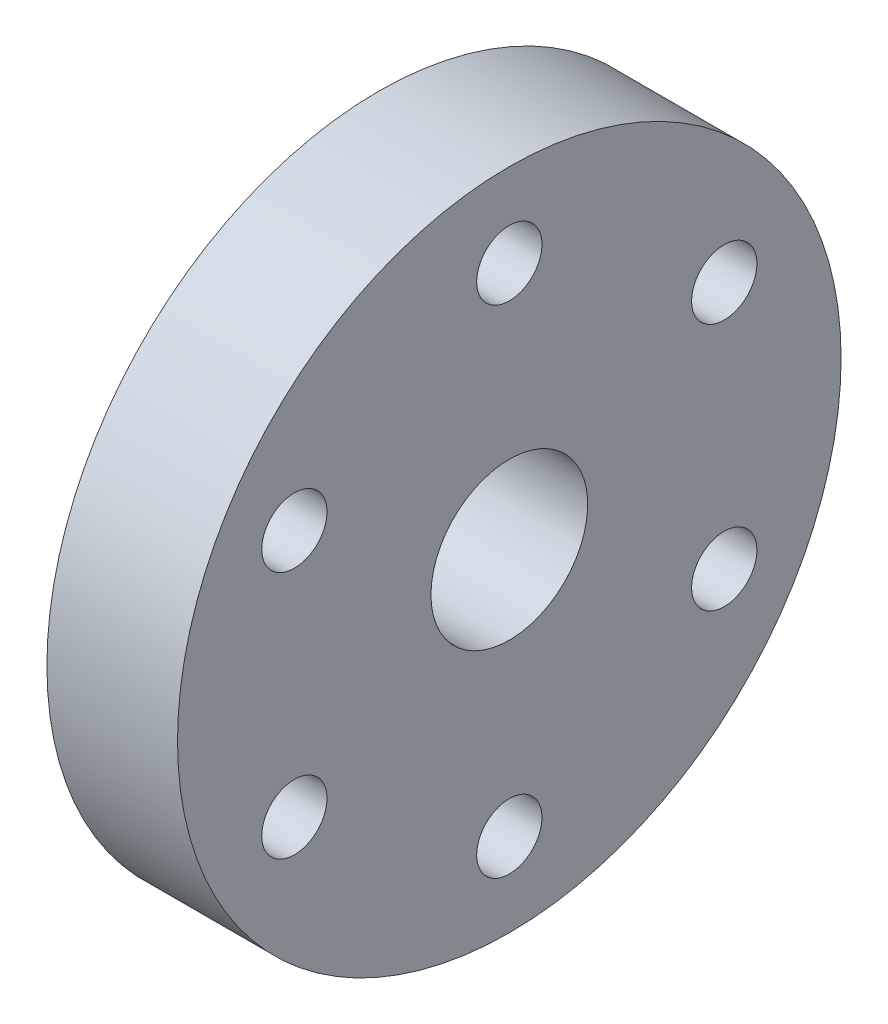
from build123d import *

# Parameters (mm, degrees)
TAP_DRILL_FOR_M3X0_5_TAP1_D = 2.5
CIRPATTERN1_COUNT           = 6


with BuildPart() as part:
    # Sketch1 → Revolve1 (revolve)
    with BuildSketch(Plane.XY, mode=Mode.PRIVATE) as revolve1_sk:
        Polygon((0, 3), (0, 6), (4.2, 6), (4.2, 12.7), (9.2, 12.7), (9.2, 3), align=None)
    revolve(revolve1_sk.sketch.rotate(Axis((0, 0, 0), (1, 0, 0)), 90), axis=Axis((0, 0, 0), (1, 0, 0)))

    # Tap Drill for M3x0.5 Tap1 (through all)
    with Locations(Plane.ZY.offset(-4.2)):
        with Locations((0, 9.5)):
            tap_drill_for_m3x0_5_tap1 = Hole(TAP_DRILL_FOR_M3X0_5_TAP1_D / 2)

    # CirPattern1: Tap Drill for M3x0.5 Tap1 ×6 about axis
    cirpattern1_axis = Axis((0, 0, 0), (1, 0, 0))
    for i in range(1, CIRPATTERN1_COUNT):
        add(tap_drill_for_m3x0_5_tap1.rotate(cirpattern1_axis, i * 360 / CIRPATTERN1_COUNT), mode=Mode.SUBTRACT)


solid = part.part
